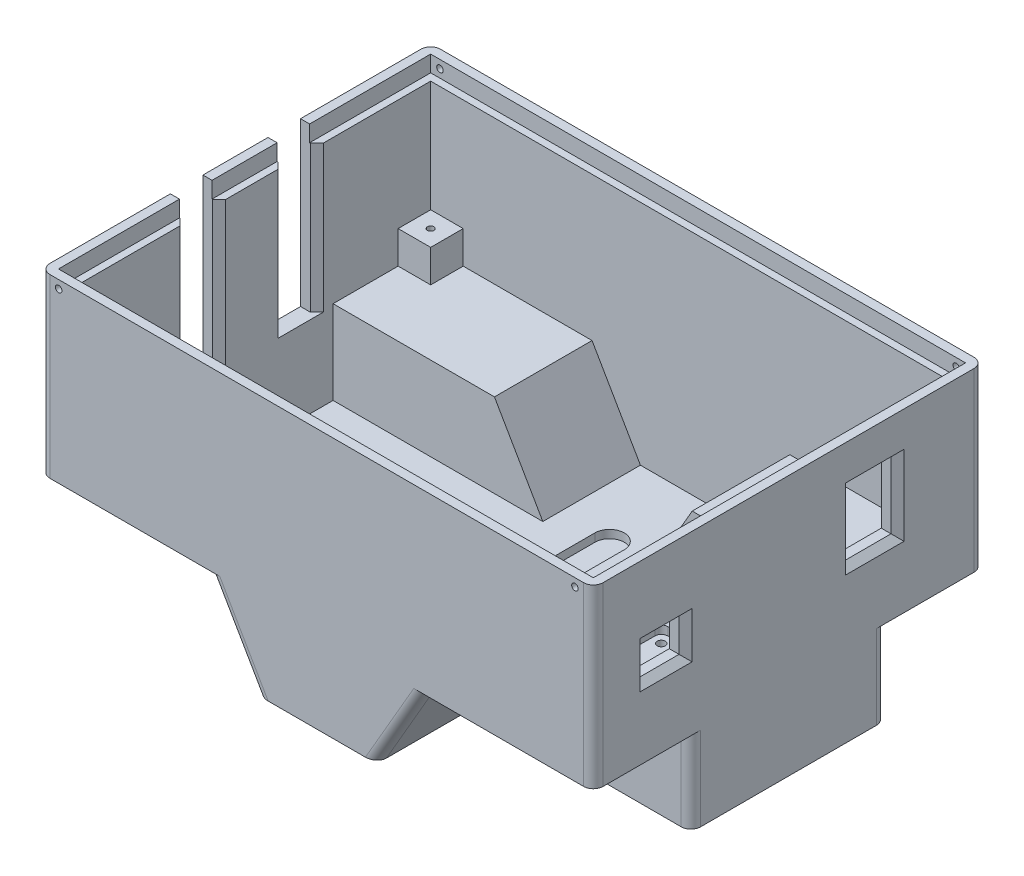
from build123d import *

# Parameters (mm, degrees)
ESBO_O7_W                = 170
ESBO_O7_H                = 120
RESSALTO_EXTRUS_O4_DEPTH = 80
CORTE_EXTRUS_O9_DEPTH    = 30
CASCA1_T                 = -5
ESBO_O9_R                = 1.25
CORTE_EXTRUS_O4_DEPTH    = 132.244047484
CORTE_EXTRUS_O5_START    = -2.5
ESBO_O10_R               = 1.25
CORTE_EXTRUS_O5_DEPTH    = 2.5
ESBO_O13_R               = 4
CORTE_EXTRUS_O7_DEPTH    = 132.244047484
CORTE_EXTRUS_O8_DEPTH    = 2.5
ESBO_O22_W               = 14
ESBO_O22_H               = 20.5
ESBO_O22_W_2             = 12.04
ESBO_O22_H_2             = 10.21
CORTE_EXTRUS_O10_DEPTH   = 193.937813816
ESBO_O23_W               = 10
ESBO_O23_H               = 50
CORTE_EXTRUS_O11_DEPTH   = 193.937813816
CHANFRO1_SIZE            = 2
FILETE2_R                = 3
ESBO_O25_W               = 164.4
ESBO_O25_H               = 114.4
CORTE_EXTRUS_O12_DEPTH   = 5
ESBO_O26_R               = 1
CORTE_EXTRUS_O13_DEPTH   = 168.406690428
ESBO_O27_W               = 10
ESBO_O27_H               = 10
ESBO_O27_R               = 1
RESSALTO_EXTRUS_O7_DEPTH = 10
CHANFRO2_SIZE            = 2


with BuildPart() as part:
    # Esboço7 → Ressalto-extrusão4 (new body)
    with BuildSketch(Plane(origin=(0, 0, 0), x_dir=(1, 0, 0), z_dir=(0, 1, 0))):
        Rectangle(ESBO_O7_W, ESBO_O7_H)
    extrude(amount=RESSALTO_EXTRUS_O4_DEPTH)

    # Esboço17 → Corte-extrusão9 (cut)
    with BuildSketch(Plane.XY.offset(60)):
        Polygon((-85, 25.75), (-33.281920983, 25.75), (-18.415151551, 0), (-85, 0), align=None)
        Polygon((85, 0), (18.415151551, 0), (33.281920983, 25.75), (85, 25.75), align=None)
    corte_extrus_o9 = extrude(amount=-CORTE_EXTRUS_O9_DEPTH, mode=Mode.SUBTRACT)

    # Espelhar3: Corte-extrusão9 across plane
    add(corte_extrus_o9.mirror(Plane.XY), mode=Mode.SUBTRACT)

    # Casca1
    casca1_openings = [part.faces().sort_by_distance(p)[0] for p in [
        (0, 80, 0),
    ]]
    offset(amount=CASCA1_T, openings=casca1_openings, kind=Kind.INTERSECTION)

    # Esboço9 → Corte-extrusão4 (cut, through all)
    with BuildSketch(Plane.XZ):
        with Locations((40.35, -13.25)):
            Circle(ESBO_O9_R)
        with Locations((32.65, -13.25)):
            Circle(ESBO_O9_R)
        with Locations((40.35, 13.25)):
            Circle(ESBO_O9_R)
        with Locations((32.65, 13.25)):
            Circle(ESBO_O9_R)
        with Locations((-30.15, 13.25)):
            Circle(ESBO_O9_R)
        with Locations((-37.85, 13.25)):
            Circle(ESBO_O9_R)
        with Locations((-30.15, -13.25)):
            Circle(ESBO_O9_R)
        with Locations((-37.85, -13.25)):
            Circle(ESBO_O9_R)
    extrude(amount=-CORTE_EXTRUS_O4_DEPTH, mode=Mode.SUBTRACT)

    # Esboço10 → Corte-extrusão5 (cut)
    # profile 1 of 2: a face of its own
    with BuildSketch(Plane(origin=(0, 5, 0), x_dir=(1, 0, 0), z_dir=(0, 1, 0)).offset(CORTE_EXTRUS_O5_START)):
        with BuildLine():
            ThreePointArc((43.35, 14.25), (42.764213562, 15.664213562), (41.35, 16.25))
            Line((41.35, 16.25), (31.65, 16.25))
            ThreePointArc((31.65, 16.25), (30.235786438, 15.664213562), (29.65, 14.25))
            Line((29.65, 14.25), (29.65, -14.25))
            ThreePointArc((29.65, -14.25), (30.235786438, -15.664213562), (31.65, -16.25))
            Line((31.65, -16.25), (41.35, -16.25))
            ThreePointArc((41.35, -16.25), (42.764213562, -15.664213562), (43.35, -14.25))
            Line((43.35, -14.25), (43.35, 14.25))
        make_face()
    # profile 2 of 2: a face of its own
    with BuildSketch(Plane(origin=(0, 5, 0), x_dir=(1, 0, 0), z_dir=(0, 1, 0)).offset(CORTE_EXTRUS_O5_START)):
        with BuildLine():
            Line((-29.15, 16.25), (-38.85, 16.25))
            ThreePointArc((-38.85, 16.25), (-40.264213562, 15.664213562), (-40.85, 14.25))
            Line((-40.85, 14.25), (-40.85, -14.25))
            ThreePointArc((-40.85, -14.25), (-40.264213562, -15.664213562), (-38.85, -16.25))
            Line((-38.85, -16.25), (-29.15, -16.25))
            ThreePointArc((-29.15, -16.25), (-27.735786438, -15.664213562), (-27.15, -14.25))
            Line((-27.15, -14.25), (-27.15, 14.25))
            ThreePointArc((-27.15, 14.25), (-27.735786438, 15.664213562), (-29.15, 16.25))
        make_face()
        with Locations((-37.85, -13.25)):
            Circle(ESBO_O10_R, mode=Mode.SUBTRACT)
        with Locations((-30.15, -13.25)):
            Circle(ESBO_O10_R, mode=Mode.SUBTRACT)
        with Locations((-37.85, 13.25)):
            Circle(ESBO_O10_R, mode=Mode.SUBTRACT)
        with Locations((-30.15, 13.25)):
            Circle(ESBO_O10_R, mode=Mode.SUBTRACT)
    extrude(amount=CORTE_EXTRUS_O5_DEPTH, mode=Mode.SUBTRACT)

    # Esboço13 → Corte-extrusão7 (cut, through all)
    with BuildSketch(Plane(origin=(0, 80, 0), x_dir=(1, 0, 0), z_dir=(0, 1, 0))):
        Circle(ESBO_O13_R)
    extrude(amount=-CORTE_EXTRUS_O7_DEPTH, mode=Mode.SUBTRACT)

    # Esboço14 → Corte-extrusão8 (cut)
    with BuildSketch(Plane(origin=(0, 5, 0), x_dir=(1, 0, 0), z_dir=(0, 1, 0))):
        with BuildLine():
            Line((-4.5, -30), (-4.5, 30))
            ThreePointArc((-4.5, 30), (0, 34.5), (4.5, 30))
            Line((4.5, 30), (4.5, -30))
            ThreePointArc((4.5, -30), (0, -34.5), (-4.5, -30))
        make_face()
    extrude(amount=-CORTE_EXTRUS_O8_DEPTH, mode=Mode.SUBTRACT)

    # Esboço22 → Corte-extrusão10 (cut, through all)
    with BuildSketch(Plane.ZY.offset(-80)):
        with Locations((-26.5, 57)):
            Rectangle(ESBO_O22_W, ESBO_O22_H)
        with Locations((37.68, 52.345)):
            Rectangle(ESBO_O22_W_2, ESBO_O22_H_2)
    extrude(amount=-CORTE_EXTRUS_O10_DEPTH, mode=Mode.SUBTRACT)

    # Esboço23 → Corte-extrusão11 (cut, through all)
    with BuildSketch(Plane(origin=(-80, 0, 0), x_dir=(0, 0, -1), z_dir=(1, 0, 0))):
        with Locations((-15, 55)):
            Rectangle(ESBO_O23_W, ESBO_O23_H)
        with Locations((15, 55)):
            Rectangle(ESBO_O23_W, ESBO_O23_H)
    extrude(amount=-CORTE_EXTRUS_O11_DEPTH, mode=Mode.SUBTRACT)

    # Chanfro1
    chanfro1_edges = [part.edges().sort_by_distance(p)[0] for p in [
        (-80, 55, 20),
        (-80, 55, -20),
        (-80, 55, -10),
        (-80, 55, 10),
    ]]
    chamfer(chanfro1_edges, length=CHANFRO1_SIZE)

    # Filete2
    filete2_edges = [part.edges().sort_by_distance(p)[0] for p in [
        (85, 12.875, 30),
        (85, 12.875, -30),
        (25.848536267, 12.875, -30),
        (25.848536267, 12.875, -60),
        (-25.848536267, 12.875, -60),
        (-25.848536267, 12.875, -30),
        (-85, 12.875, -30),
        (-85, 12.875, 30),
        (-25.848536267, 12.875, 30),
        (25.848536267, 12.875, 30),
        (25.848536267, 12.875, 60),
        (-25.848536267, 12.875, 60),
        (-85, 52.875, 60),
        (-85, 52.875, -60),
        (85, 52.875, -60),
        (85, 52.875, 60),
    ]]
    fillet(filete2_edges, radius=FILETE2_R)

    # Esboço25 → Corte-extrusão12 (cut)
    with BuildSketch(Plane(origin=(0, 80, 0), x_dir=(1, 0, 0), z_dir=(0, 1, 0))):
        Rectangle(ESBO_O25_W, ESBO_O25_H)
    extrude(amount=-CORTE_EXTRUS_O12_DEPTH, mode=Mode.SUBTRACT)

    # Esboço26 → Corte-extrusão13 (cut, through all)
    with BuildSketch(Plane(origin=(0, 0, -60), x_dir=(-1, 0, 0), z_dir=(0, 0, -1))):
        with Locations((-79.35, 77.5)):
            Circle(ESBO_O26_R)
        with Locations((79.35, 77.5)):
            Circle(ESBO_O26_R)
    extrude(amount=-CORTE_EXTRUS_O13_DEPTH, mode=Mode.SUBTRACT)

    # Esboço27 → Ressalto-extrusão7 (add)
    # profile 1 of 4: a face of its own
    with BuildSketch(Plane(origin=(0, 30.75, 0), x_dir=(1, 0, 0), z_dir=(0, 1, 0))):
        with Locations((-75, 50)):
            Rectangle(ESBO_O27_W, ESBO_O27_H)
        with Locations((-75, 50)):
            Circle(ESBO_O27_R, mode=Mode.SUBTRACT)
    # profile 2 of 4: a face of its own
    with BuildSketch(Plane(origin=(0, 30.75, 0), x_dir=(1, 0, 0), z_dir=(0, 1, 0))):
        with Locations((75, 50)):
            Rectangle(ESBO_O27_W, ESBO_O27_H)
        with Locations((75, 50)):
            Circle(ESBO_O27_R, mode=Mode.SUBTRACT)
    # profile 3 of 4: a face of its own
    with BuildSketch(Plane(origin=(0, 30.75, 0), x_dir=(1, 0, 0), z_dir=(0, 1, 0))):
        with Locations((75, -50)):
            Rectangle(ESBO_O27_W, ESBO_O27_H)
        with Locations((75, -50)):
            Circle(ESBO_O27_R, mode=Mode.SUBTRACT)
    # profile 4 of 4: a face of its own
    with BuildSketch(Plane(origin=(0, 30.75, 0), x_dir=(1, 0, 0), z_dir=(0, 1, 0))):
        with Locations((-75, -50)):
            Rectangle(ESBO_O27_W, ESBO_O27_H)
        with Locations((-75, -50)):
            Circle(ESBO_O27_R, mode=Mode.SUBTRACT)
    extrude(amount=RESSALTO_EXTRUS_O7_DEPTH)

    # Chanfro2
    chanfro2_edges = [part.edges().sort_by_distance(p)[0] for p in [
        (85, 47.24, 37.68),
        (85, 52.345, 43.7),
        (85, 57.45, 37.68),
        (85, 52.345, 31.66),
        (85, 46.75, -26.5),
        (85, 57, -19.5),
        (85, 67.25, -26.5),
        (85, 57, -33.5),
    ]]
    chamfer(chanfro2_edges, length=CHANFRO2_SIZE)


solid = part.part
